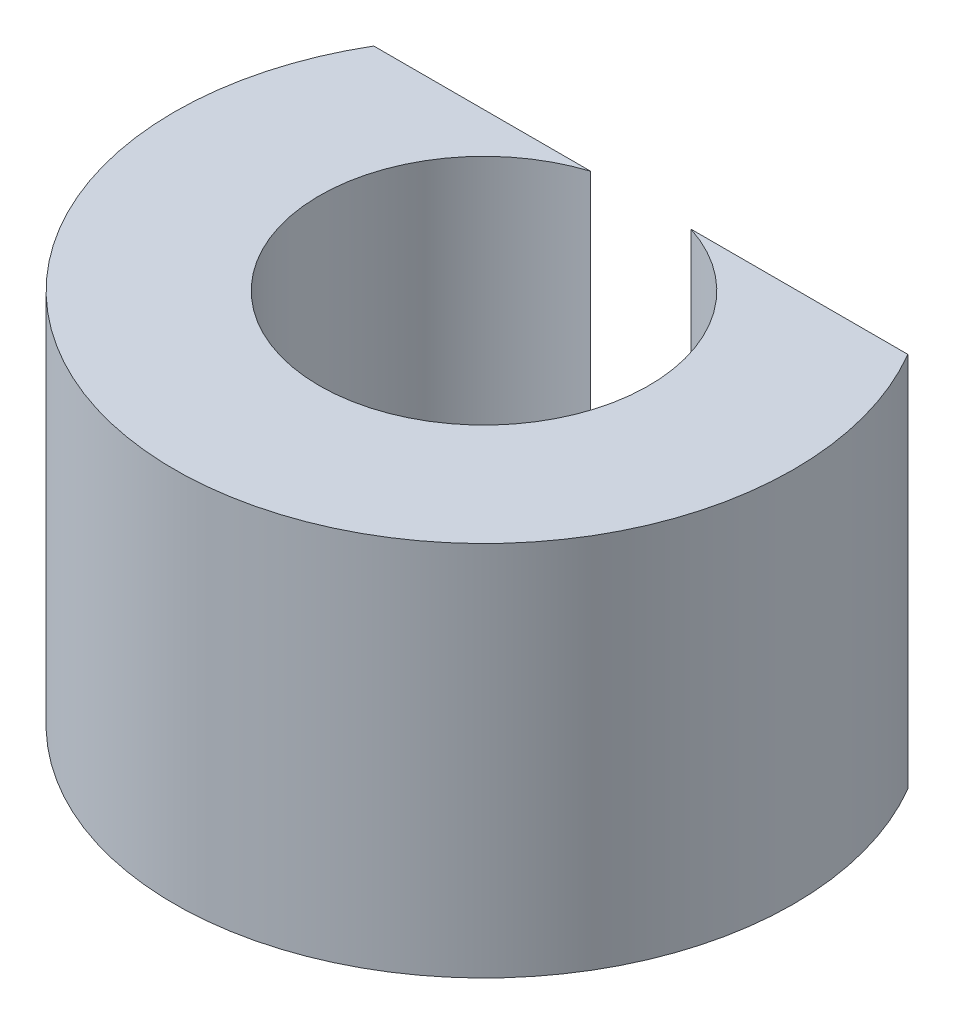
from build123d import *

# Parameters (mm, degrees)
BOSS_EXTRUDE1_DEPTH = 2.4
SKETCH2_R           = 1.05
CUT_EXTRUDE1_DEPTH  = 4.682560251


with BuildPart() as part:
    # Sketch1 → Boss-Extrude1 (new body)
    with BuildSketch(Plane(origin=(0, 0, 0), x_dir=(1, 0, 0), z_dir=(0, 1, 0))):
        with BuildLine():
            Line((1.703122133, 1), (-1.703122133, 1))
            ThreePointArc((-1.703122133, 1), (-0.518149972, -1.905818881), (1.975, 0))
            ThreePointArc((1.975, 0), (1.905818881, 0.518149972), (1.703122133, 1))
        make_face()
    extrude(amount=BOSS_EXTRUDE1_DEPTH)

    # Sketch2 → Cut-Extrude1 (cut, through all)
    with BuildSketch(Plane(origin=(0, 2.4, 0), x_dir=(1, 0, 0), z_dir=(0, 1, 0))):
        Circle(SKETCH2_R)
    extrude(amount=-CUT_EXTRUDE1_DEPTH, mode=Mode.SUBTRACT)


solid = part.part
